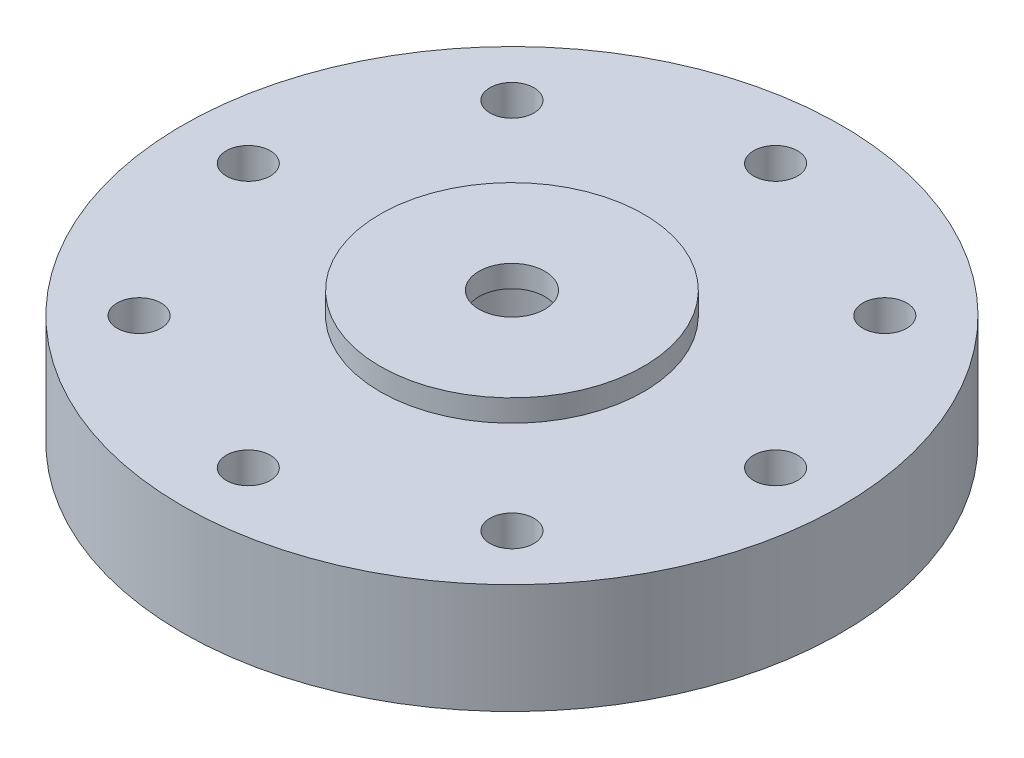
from build123d import *

# Parameters (mm, degrees)
SKETCH1_R           = 15
SKETCH1_R_2         = 1
BOSS_EXTRUDE1_DEPTH = 5
SKETCH2_R           = 6
BOSS_EXTRUDE2_DEPTH = 1
SKETCH3_R           = 3
CUT_EXTRUDE1_DEPTH  = 5
SKETCH4_R           = 1.5
CUT_EXTRUDE2_DEPTH  = 5


with BuildPart() as part:
    # Sketch1 → Boss-Extrude1 (new body)
    with BuildSketch(Plane(origin=(0, 0, 0), x_dir=(1, 0, 0), z_dir=(0, 1, 0))):
        with Locations(Location((0, 0, 0), (0, 0, 270))):
            Circle(SKETCH1_R)
        with Locations(Location((0, 12, 0), (0, 0, 270))):
            Circle(SKETCH1_R_2, mode=Mode.SUBTRACT)
        with Locations(Location((8.485281374, 8.485281374, 0), (0, 0, 270))):
            Circle(SKETCH1_R_2, mode=Mode.SUBTRACT)
        with Locations(Location((12, 0, 0), (0, 0, 270))):
            Circle(SKETCH1_R_2, mode=Mode.SUBTRACT)
        with Locations(Location((8.485281374, -8.485281374, 0), (0, 0, 270))):
            Circle(SKETCH1_R_2, mode=Mode.SUBTRACT)
        with Locations(Location((0, -12, 0), (0, 0, 270))):
            Circle(SKETCH1_R_2, mode=Mode.SUBTRACT)
        with Locations(Location((-8.485281374, -8.485281374, 0), (0, 0, 270))):
            Circle(SKETCH1_R_2, mode=Mode.SUBTRACT)
        with Locations(Location((-12, 0, 0), (0, 0, 270))):
            Circle(SKETCH1_R_2, mode=Mode.SUBTRACT)
        with Locations(Location((-8.485281374, 8.485281374, 0), (0, 0, 270))):
            Circle(SKETCH1_R_2, mode=Mode.SUBTRACT)
    extrude(amount=BOSS_EXTRUDE1_DEPTH)

    # Sketch2 → Boss-Extrude2 (add)
    with BuildSketch(Plane(origin=(0, 5, 0), x_dir=(1, 0, 0), z_dir=(0, 1, 0))):
        with Locations(Location((0, 0, 0), (0, 0, 270))):
            Circle(SKETCH2_R)
    extrude(amount=BOSS_EXTRUDE2_DEPTH)

    # Sketch3 → Cut-Extrude1 (cut)
    with BuildSketch(Plane.XZ):
        with Locations(Location((0, 0, 0), (0, 0, 270))):
            Circle(SKETCH3_R)
    extrude(amount=-CUT_EXTRUDE1_DEPTH, mode=Mode.SUBTRACT)

    # Sketch4 → Cut-Extrude2 (cut)
    with BuildSketch(Plane(origin=(0, 6, 0), x_dir=(1, 0, 0), z_dir=(0, 1, 0))):
        with Locations(Location((0, 0, 0), (0, 0, 270))):
            Circle(SKETCH4_R)
    extrude(amount=-CUT_EXTRUDE2_DEPTH, mode=Mode.SUBTRACT)


solid = part.part
